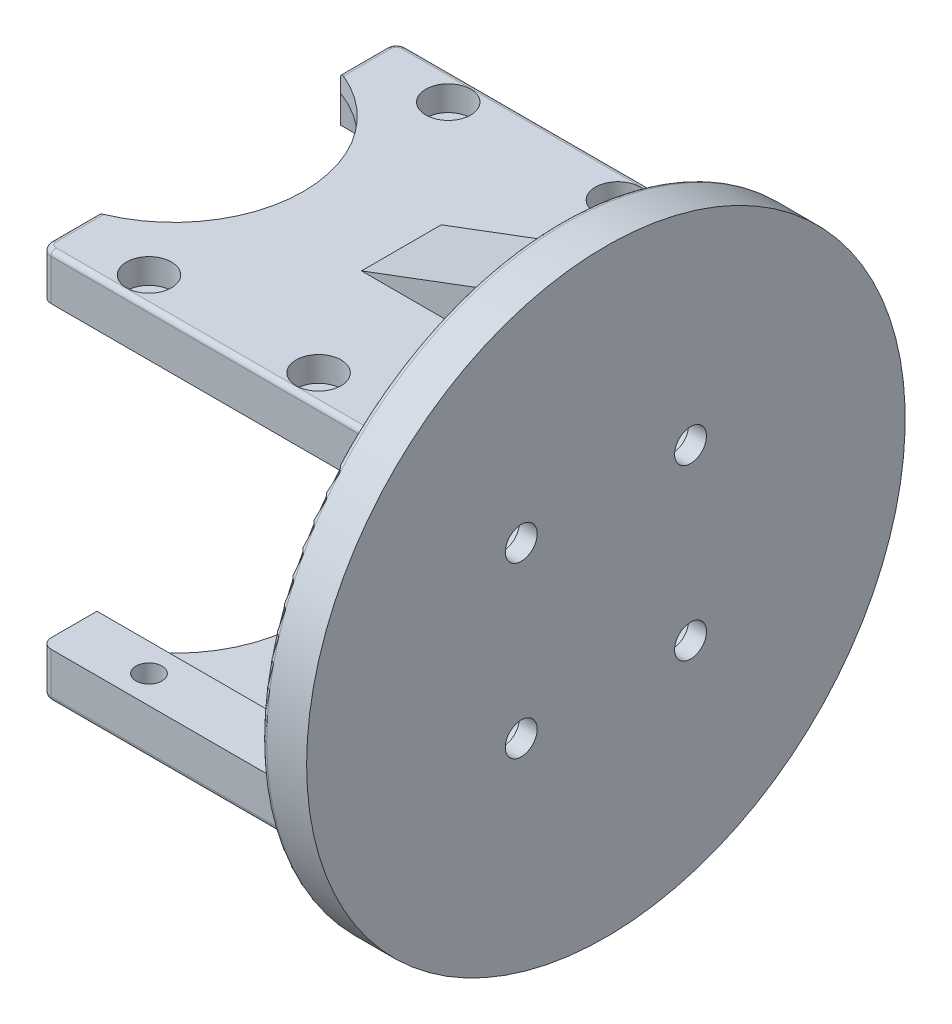
from build123d import *

# Parameters (mm, degrees)
SKETCH1_R           = 1.3
BOSS_EXTRUDE1_DEPTH = 2.8
BOSS_EXTRUDE2_START = -1.8
SKETCH2_R           = 1.3
BOSS_EXTRUDE2_DEPTH = 1.8
SKETCH3_R           = 2.25
CUT_EXTRUDE1_DEPTH  = 2.5
SKETCH4_W           = 35.6
SKETCH4_H           = 4.6
BOSS_EXTRUDE3_DEPTH = 5
SKETCH5_W           = 4.5
SKETCH5_H           = 35.6
BOSS_EXTRUDE4_DEPTH = 15
FILLET1_R           = 1
CUT_EXTRUDE4_DEPTH  = 3.5
SKETCH10_R          = 30
BOSS_EXTRUDE6_DEPTH = 4.5
SKETCH6_R           = 1.6
CUT_EXTRUDE2_DEPTH  = 69.491291157
SKETCH8_R           = 2.8
CUT_EXTRUDE3_DEPTH  = 2.7
RIB1_REACH          = 73.132
SKETCH11_WALL_W     = 161.35156572
SKETCH11_WALL_H     = 8
FILLET2_R           = 0.5
FILLET3_R           = 0.5


with BuildPart() as part:
    # Sketch1 → Boss-Extrude1 (new body)
    with BuildSketch(Plane(origin=(0, 0, 0), x_dir=(1, 0, 0), z_dir=(0, 1, 0))):
        Polygon((4.489988864, 12.2), (4.489988864, 17.8), (38.3, 17.8), (38.3, -17.8), (4.489988864, -17.8), (4.489988864, -12.2), (33.2, -12.2), (33.2, 12.2), align=None)
        with Locations(Location((12.5, 15, 0), (0, 0, 270))):
            Circle(SKETCH1_R, mode=Mode.SUBTRACT)
        with Locations(Location((29.5, 15, 0), (0, 0, 270))):
            Circle(SKETCH1_R, mode=Mode.SUBTRACT)
        with Locations(Location((12.5, -15, 0), (0, 0, 270))):
            Circle(SKETCH1_R, mode=Mode.SUBTRACT)
        with Locations(Location((29.5, -15, 0), (0, 0, 270))):
            Circle(SKETCH1_R, mode=Mode.SUBTRACT)
        with Locations(Location((35.75, -8.5, 0), (0, 0, 270))):
            Circle(SKETCH1_R, mode=Mode.SUBTRACT)
        with Locations(Location((35.75, 8.5, 0), (0, 0, 270))):
            Circle(SKETCH1_R, mode=Mode.SUBTRACT)
    boss_extrude1 = extrude(amount=BOSS_EXTRUDE1_DEPTH)

    # Sketch2 → Boss-Extrude2 (add)
    # profile 1 of 2: a face of its own
    with BuildSketch(Plane(origin=(0, 0, 0), x_dir=(1, 0, 0), z_dir=(0, 1, 0)).offset(BOSS_EXTRUDE2_START)):
        with BuildLine():
            ThreePointArc((4.489988864, -12.2), (13, 0), (4.489988864, 12.2))
            Line((4.489988864, 12.2), (33.2, 12.2))
            Line((33.2, 12.2), (33.2, -12.2))
            Line((33.2, -12.2), (4.489988864, -12.2))
        make_face()
    # profile 2 of 2: a face of its own
    with BuildSketch(Plane(origin=(0, 0, 0), x_dir=(1, 0, 0), z_dir=(0, 1, 0)).offset(BOSS_EXTRUDE2_START)):
        Polygon((4.489988864, 12.2), (4.489988864, 17.8), (38.3, 17.8), (38.3, -17.8), (4.489988864, -17.8), (4.489988864, -12.2), (33.2, -12.2), (33.2, 12.2), align=None)
        with Locations(Location((12.5, -15, 0), (0, 0, 270))):
            Circle(SKETCH2_R, mode=Mode.SUBTRACT)
        with Locations(Location((29.5, -15, 0), (0, 0, 270))):
            Circle(SKETCH2_R, mode=Mode.SUBTRACT)
        with Locations(Location((35.75, -8.5, 0), (0, 0, 270))):
            Circle(SKETCH2_R, mode=Mode.SUBTRACT)
        with Locations(Location((35.75, 8.5, 0), (0, 0, 270))):
            Circle(SKETCH2_R, mode=Mode.SUBTRACT)
        with Locations(Location((29.5, 15, 0), (0, 0, 270))):
            Circle(SKETCH2_R, mode=Mode.SUBTRACT)
        with Locations(Location((12.5, 15, 0), (0, 0, 270))):
            Circle(SKETCH2_R, mode=Mode.SUBTRACT)
    boss_extrude2 = extrude(amount=BOSS_EXTRUDE2_DEPTH)

    # Sketch3 → Cut-Extrude1 (cut)
    with BuildSketch(Plane.XZ.offset(1.8)):
        with Locations(Location((12.5, 15, 0), (0, 0, 270))):
            Circle(SKETCH3_R)
        with Locations(Location((29.5, 15, 0), (0, 0, 270))):
            Circle(SKETCH3_R)
        with Locations(Location((29.5, -15, 0), (0, 0, 270))):
            Circle(SKETCH3_R)
        with Locations(Location((12.5, -15, 0), (0, 0, 270))):
            Circle(SKETCH3_R)
        with Locations(Location((35.75, 8.5, 0), (0, 0, 270))):
            Circle(SKETCH3_R)
        with Locations(Location((35.75, -8.5, 0), (0, 0, 270))):
            Circle(SKETCH3_R)
    cut_extrude1 = extrude(amount=-CUT_EXTRUDE1_DEPTH, mode=Mode.SUBTRACT)

    # Sketch4 → Boss-Extrude3 (add)
    with BuildSketch(Plane(origin=(38.3, 0, 0), x_dir=(0, 0, -1), z_dir=(1, 0, 0))):
        with Locations((0, 0.5)):
            Rectangle(SKETCH4_W, SKETCH4_H)
    boss_extrude3 = extrude(amount=BOSS_EXTRUDE3_DEPTH)

    # Sketch5 → Boss-Extrude4 (add)
    with BuildSketch(Plane(origin=(0, 2.8, 0), x_dir=(1, 0, 0), z_dir=(0, 1, 0))):
        with Locations((41.05, 0)):
            Rectangle(SKETCH5_W, SKETCH5_H)
    boss_extrude4 = extrude(amount=BOSS_EXTRUDE4_DEPTH)

    # Mirror3: Boss-Extrude1, Boss-Extrude2, Cut-Extrude1, Boss-Extrude3, Boss-Extrude4 across plane
    add(boss_extrude1.mirror(Plane.ZX.offset(17.8)))
    add(boss_extrude2.mirror(Plane.ZX.offset(17.8)))
    add(cut_extrude1.mirror(Plane.ZX.offset(17.8)), mode=Mode.SUBTRACT)
    add(boss_extrude3.mirror(Plane.ZX.offset(17.8)))
    add(boss_extrude4.mirror(Plane.ZX.offset(17.8)))

    # Fillet1
    fillet1_edges = [part.edges().sort_by_distance(p)[0] for p in [
        (4.489988864, 35.1, -17.8),
        (4.489988864, 35.1, 17.8),
        (4.489988864, 0.5, 17.8),
        (4.489988864, 0.5, -17.8),
    ]]
    fillet(fillet1_edges, radius=FILLET1_R)

    # Sketch9 → Cut-Extrude4 (cut)
    with BuildSketch(Plane(origin=(43.3, 0, 0), x_dir=(0, 0, -1), z_dir=(1, 0, 0))):
        with BuildLine():
            Line((-2.05, 21.85), (2.05, 21.85))
            ThreePointArc((2.05, 21.85), (3.464213562, 21.264213562), (4.05, 19.85))
            Line((4.05, 19.85), (4.05, 15.75))
            ThreePointArc((4.05, 15.75), (3.464213562, 14.335786438), (2.05, 13.75))
            Line((2.05, 13.75), (-2.05, 13.75))
            ThreePointArc((-2.05, 13.75), (-3.464213562, 14.335786438), (-4.05, 15.75))
            Line((-4.05, 15.75), (-4.05, 19.85))
            ThreePointArc((-4.05, 19.85), (-3.464213562, 21.264213562), (-2.05, 21.85))
        make_face()
    extrude(amount=-CUT_EXTRUDE4_DEPTH, mode=Mode.SUBTRACT)

    # Sketch10 → Boss-Extrude6 (add)
    with BuildSketch(Plane.ZY.offset(-38.8)):
        with Locations((0, 17.8)):
            Circle(SKETCH10_R)
    extrude(amount=-BOSS_EXTRUDE6_DEPTH)

    # Sketch6 → Cut-Extrude2 (cut, through all)
    with BuildSketch(Plane(origin=(43.3, 0, 0), x_dir=(0, 0, -1), z_dir=(1, 0, 0))):
        with Locations((-8.485281374, 26.285281374)):
            Circle(SKETCH6_R)
        with Locations((8.485281374, 26.285281374)):
            Circle(SKETCH6_R)
        with Locations((8.485281374, 9.314718626)):
            Circle(SKETCH6_R)
        with Locations((-8.485281374, 9.314718626)):
            Circle(SKETCH6_R)
    extrude(amount=-CUT_EXTRUDE2_DEPTH, mode=Mode.SUBTRACT)

    # Sketch8 → Cut-Extrude3 (cut)
    with BuildSketch(Plane.ZY.offset(-38.8)):
        with Locations((-8.485281374, 26.285281374)):
            Circle(SKETCH8_R)
        with Locations((8.485281374, 26.285281374)):
            Circle(SKETCH8_R)
        with Locations((8.485281374, 9.314718626)):
            Circle(SKETCH8_R)
        with Locations((-8.485281374, 9.314718626)):
            Circle(SKETCH8_R)
    extrude(amount=-CUT_EXTRUDE3_DEPTH, mode=Mode.SUBTRACT)

    # Sketch11 wall → Rib1 (add, up to next)
    with BuildSketch(Plane(origin=(30.8, 40.4, 0), x_dir=(-0.936329177569, -0.351123441588, 0), z_dir=(0.351123441588, -0.936329177569, 0)), mode=Mode.PRIVATE) as rib1_sk1:
        Rectangle(SKETCH11_WALL_W, SKETCH11_WALL_H)
    rib1_tool1 = extrude(rib1_sk1.sketch, amount=RIB1_REACH, mode=Mode.PRIVATE) - part.part
    rib1 = rib1_tool1.solids().sort_by_distance((30.8, 40.4, 0))[0]
    add(rib1)

    # Mirror4: Rib1 across plane
    add(rib1.mirror(Plane.ZX.offset(17.8)))

    # Fillet2
    fillet2_edges = [part.edges().sort_by_distance(p)[0] for p in [
        (38.8, 17.8, -30),
    ]]
    fillet(fillet2_edges, radius=FILLET2_R)

    # Fillet3
    fillet3_edges = [part.edges().sort_by_distance(p)[0] for p in [
        (4.489988864, 37.4, -14.5),
        (22.144994432, -1.8, -17.8),
        (22.144994432, -1.8, 17.8),
        (4.489988864, -1.8, 14.5),
        (4.782882083, -1.8, 17.507106781),
        (4.782882083, -1.8, -17.507106781),
        (22.144994432, 37.4, -17.8),
        (4.489988864, 37.4, 14.5),
        (22.144994432, 37.4, 17.8),
        (4.782882083, 37.4, 17.507106781),
        (4.782882083, 37.4, -17.507106781),
        (38.8, 37.4, 10.9),
        (38.8, -1.8, -10.9),
        (38.8, 0.5, 17.8),
        (38.8, 35.1, 17.8),
        (38.8, 0.5, -17.8),
        (38.8, 35.1, -17.8),
        (38.8, 37.4, -10.9),
        (38.8, 43.4, 0),
        (38.8, 40.4, 4),
        (38.8, 40.4, -4),
        (38.8, -1.8, 10.9),
        (38.8, -7.8, 0),
        (38.8, -4.8, 4),
        (38.8, -4.8, -4),
        (4.489988864, -1.8, -14.5),
    ]]
    fillet(fillet3_edges, radius=FILLET3_R)


solid = part.part
